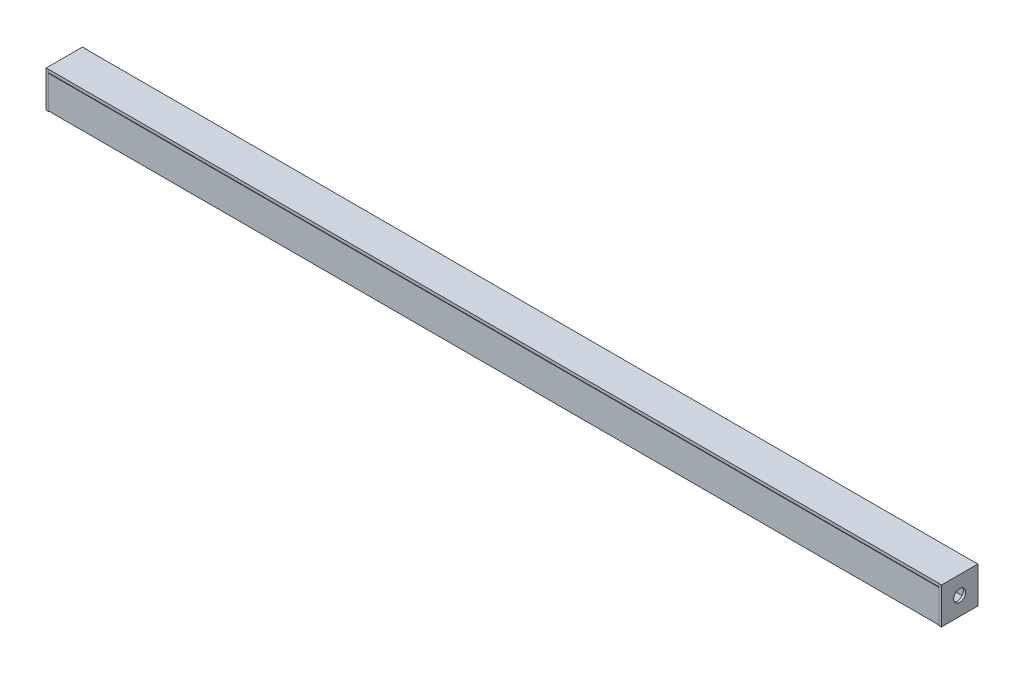
from build123d import *

# Parameters (mm, degrees)
SKETCH_1_W          = 15
SKETCH_1_H          = 15
EXTRUDE_1_DEPTH     = 372
SKETCH_2_R          = 2.6
SKETCH_2_W          = 0.2
SKETCH_2_H          = 0.2
CUT_EXTRUDE_2_DEPTH = 372
SKETCH_3_W          = 370
SKETCH_3_H          = 13
CUT_EXTRUDE_3_DEPTH = 1
SKETCH_4_W          = 15
SKETCH_4_H          = 15
CUT_EXTRUDE_4_DEPTH = 1
SKETCH_5_W          = 15
SKETCH_5_H          = 15
CUT_EXTRUDE_5_DEPTH = 1
SKETCH_6_W          = 12.6
SKETCH_6_H          = 11.399012469
CUT_EXTRUDE_6_DEPTH = 370
SKETCH_7_W          = 15.2
SKETCH_7_H          = 15.1
SKETCH_7_R          = 2.5
EXTRUDE_4_DEPTH     = 1
EXTRUDE_START       = 1
SKETCH_8_W          = 15.2
SKETCH_8_H          = 15.1
SKETCH_8_R          = 2.5
EXTRUDE_5_DEPTH     = 1


with BuildPart() as part:
    # 草图1 → 凸台-拉伸1 (new body)
    with BuildSketch(Plane(origin=(0, 0, 0), x_dir=(0, 0, -1), z_dir=(1, 0, 0))):
        with Locations((-16.757142857, 9.442767842)):
            Rectangle(SKETCH_1_W, SKETCH_1_H)
    extrude(amount=EXTRUDE_1_DEPTH)

    # 草图2 → 切除-拉伸2 (cut)
    with BuildSketch(Plane(origin=(372, 0, 0), x_dir=(0, 0, -1), z_dir=(1, 0, 0))):
        with Locations((-16.757142857, 9.442767842)):
            Circle(SKETCH_2_R)
        with Locations((-24.157142857, 15.588150761)):
            Rectangle(SKETCH_2_W, SKETCH_2_H)
        with Locations((-9.357142857, 15.588150761)):
            Rectangle(SKETCH_2_W, SKETCH_2_H)
    extrude(amount=-CUT_EXTRUDE_2_DEPTH, mode=Mode.SUBTRACT)

    # 草图3 → 切除-拉伸3 (cut)
    with BuildSketch(Plane.XZ.offset(-1.942767842)):
        with Locations((186, 16.757142857)):
            Rectangle(SKETCH_3_W, SKETCH_3_H)
    extrude(amount=-CUT_EXTRUDE_3_DEPTH, mode=Mode.SUBTRACT)

    # 草图4 → 切除-拉伸4 (cut)
    with BuildSketch(Plane.ZY):
        with Locations((16.757142857, 9.442767842)):
            Rectangle(SKETCH_4_W, SKETCH_4_H)
    extrude(amount=-CUT_EXTRUDE_4_DEPTH, mode=Mode.SUBTRACT)

    # 草图5 → 切除-拉伸5 (cut)
    with BuildSketch(Plane(origin=(372, 0, 0), x_dir=(0, 0, -1), z_dir=(1, 0, 0))):
        with Locations((-16.757142857, 9.442767842)):
            Rectangle(SKETCH_5_W, SKETCH_5_H)
    extrude(amount=-CUT_EXTRUDE_5_DEPTH, mode=Mode.SUBTRACT)

    # 草图6 → 切除-拉伸6 (cut)
    with BuildSketch(Plane(origin=(371, 0, 0), x_dir=(0, 0, -1), z_dir=(1, 0, 0))):
        with Locations((-16.757142857, 9.243261608)):
            Rectangle(SKETCH_6_W, SKETCH_6_H)
    extrude(amount=-CUT_EXTRUDE_6_DEPTH, mode=Mode.SUBTRACT)

    # 草图7 → 凸台-拉伸4 (add)
    with BuildSketch(Plane(origin=(371, 0, 0), x_dir=(0, 0, -1), z_dir=(1, 0, 0))):
        with Locations((-16.757142857, 9.392767842)):
            Rectangle(SKETCH_7_W, SKETCH_7_H)
        with Locations((-16.757142857, 9.392767842)):
            Circle(SKETCH_7_R, mode=Mode.SUBTRACT)
    extrude(amount=EXTRUDE_4_DEPTH)

    # 草图8 → 凸台-拉伸5 (add)
    with BuildSketch(Plane.ZY.offset(-1).offset(EXTRUDE_START)):
        with Locations((16.757142857, 9.392767842)):
            Rectangle(SKETCH_8_W, SKETCH_8_H)
        with Locations(Location((16.757142857, 9.392767842, 0), (0, 0, 180))):
            Circle(SKETCH_8_R, mode=Mode.SUBTRACT)
    extrude(amount=-EXTRUDE_5_DEPTH)


solid = part.part
